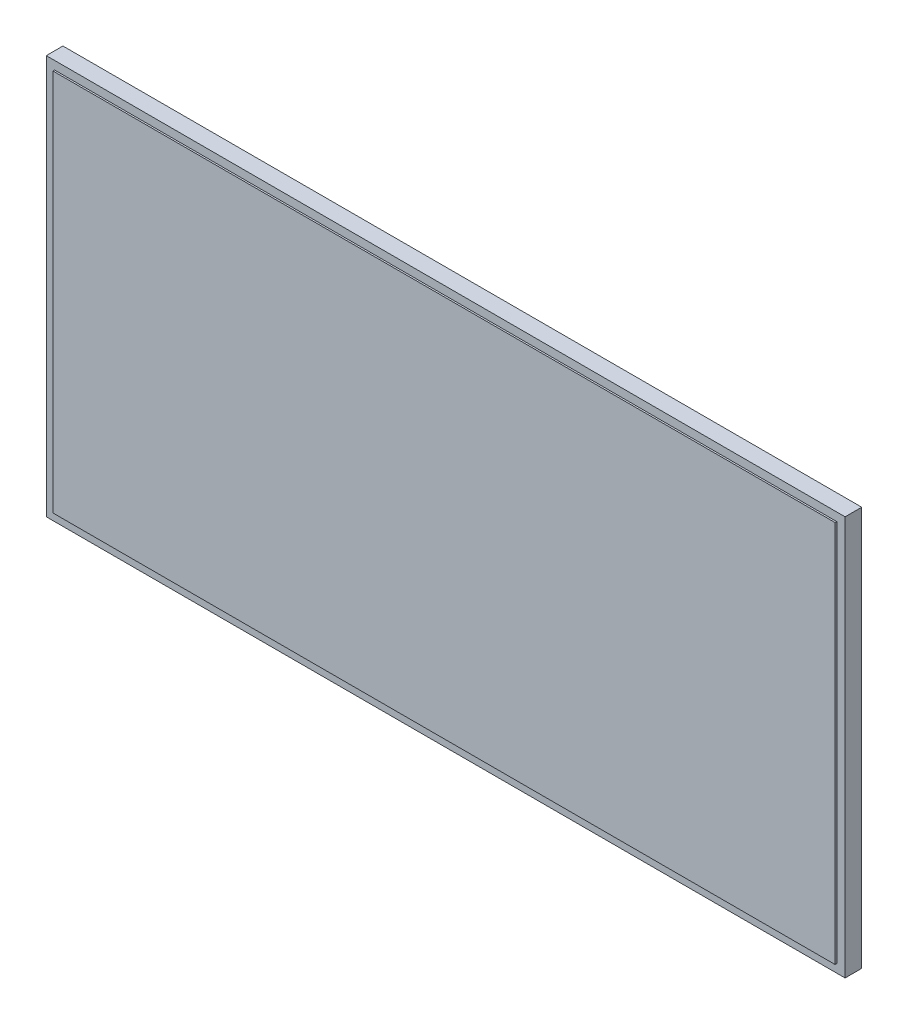
from build123d import *

# Parameters (mm, degrees)
SKETCH1_W                = 6096
SKETCH1_H                = 3048
BOSS_EXTRUDE2_DEPTH      = 127
CUT_EXTRUDE1_REACH       = 6818.718
SKETCH3_W                = 5969
SKETCH3_H                = 2921
BOSS_EXTRUDE3_DEPTH      = 12.7
BOSS_EXTRUDE3_DEPTH_BACK = 139.7
SKETCH4_W                = 5969
SKETCH4_H                = 2921


with BuildPart() as part:
    # Sketch1 → Boss-Extrude2 (new body)
    with BuildSketch(Plane.XY):
        with Locations((-3048, -1524)):
            Rectangle(SKETCH1_W, SKETCH1_H)
    extrude(amount=BOSS_EXTRUDE2_DEPTH)

    # Sketch3 → Cut-Extrude1 (cut, up to next)
    with BuildSketch(Plane.XY.offset(127), mode=Mode.PRIVATE) as cut_extrude1_sk1:
        with Locations((-3048, -1524)):
            Rectangle(SKETCH3_W, SKETCH3_H)
    cut_extrude1_tool1 = extrude(cut_extrude1_sk1.sketch, amount=-CUT_EXTRUDE1_REACH, mode=Mode.PRIVATE) & part.part
    add(cut_extrude1_tool1.solids().sort_by_distance((-3048, -1524, 127))[0], mode=Mode.SUBTRACT)

    # Sketch4 → Boss-Extrude3 (add, two sides: drawn at the far end of the back side and taken through both)
    with BuildSketch(Plane.XY.offset(127).offset(-BOSS_EXTRUDE3_DEPTH_BACK)):
        with Locations((-3048, -1524)):
            Rectangle(SKETCH4_W, SKETCH4_H)
    extrude(amount=BOSS_EXTRUDE3_DEPTH + BOSS_EXTRUDE3_DEPTH_BACK)


solid = part.part
